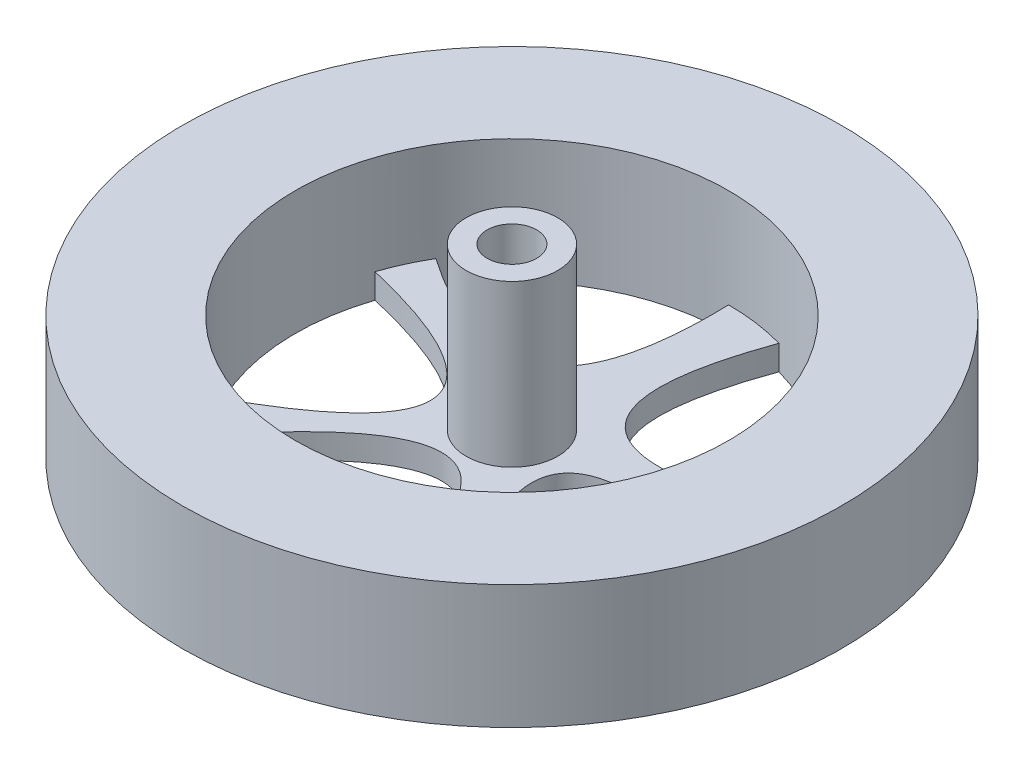
from build123d import *

# Parameters (mm, degrees)
SKETCH3_R           = 31.75
BOSS_EXTRUDE1_DEPTH = 12.7
SKETCH4_R           = 22.225
CUT_EXTRUDE1_DEPTH  = 10.16
CUT_EXTRUDE2_DEPTH  = 10.16
SKETCH8_R           = 4.694761347
BOSS_EXTRUDE2_DEPTH = 16.51
SKETCH9_R           = 2.54
CUT_EXTRUDE3_DEPTH  = 10.16
SKETCH10_W          = 2.065443221
SKETCH10_H          = 12.7


with BuildPart() as part:
    # Sketch3 → Boss-Extrude1 (new body)
    with BuildSketch(Plane(origin=(0, 0, 0), x_dir=(1, 0, 0), z_dir=(0, 1, 0))):
        with Locations(Location((0, 0, 0), (0, 0, 270))):
            Circle(SKETCH3_R)
    extrude(amount=BOSS_EXTRUDE1_DEPTH)

    # Sketch4 → Cut-Extrude1 (cut)
    with BuildSketch(Plane(origin=(0, 12.7, 0), x_dir=(1, 0, 0), z_dir=(0, 1, 0))):
        with Locations(Location((0, 0, 0), (0, 0, 270))):
            Circle(SKETCH4_R)
    extrude(amount=-CUT_EXTRUDE1_DEPTH, mode=Mode.SUBTRACT)

    # Sketch7 → Cut-Extrude2 (cut)
    with BuildSketch(Plane(origin=(0, 2.54, 0), x_dir=(1, 0, 0), z_dir=(0, 1, 0))):
        with BuildLine():
            ThreePointArc((-15.229385619, -16.18692184), (-5.02164827, -21.65025805), (6.548839828, -21.238251385))
            add(Edge.make_bspline(
                [(-15.229385619, -16.18692184), (3.307519141, 7.259643736), (6.548839828, -21.238251385)],
                knots=[0, 0, 0, 1, 1, 1], degree=2))
        make_face()
        with BuildLine():
            ThreePointArc((13.050551616, -17.989822887), (19.536316665, -10.596365234), (22.196363392, -1.127863993))
            add(Edge.make_bspline(
                [(13.050551616, -17.989822887), (-5.30189954, 6.172036524), (22.196363392, -1.127863993)],
                knots=[0, 0, 0, 1, 1, 1], degree=2))
        make_face()
        with BuildLine():
            ThreePointArc((21.254913667, 6.494556954), (15.531294033, 15.897469316), (5.997580887, 21.400459072))
            add(Edge.make_bspline(
                [(5.997580887, 21.400459072), (-2.424740226, -1.907285391), (21.254913667, 6.494556954)],
                knots=[0, 0, 0, 1, 1, 1], degree=2))
        make_face()
        with BuildLine():
            ThreePointArc((0, 22.225), (-11.007401994, 19.307711577), (-19.125106224, 11.321702033))
            add(Edge.make_bspline(
                [(0, 22.225), (0.733559441, -2.419288654), (-19.125106224, 11.321702033)],
                knots=[0, 0, 0, 1, 1, 1], degree=2))
        make_face()
        with BuildLine():
            ThreePointArc((-21.0799969, 7.041615986), (-22.014836277, -3.049198044), (-18.372518541, -12.506046036))
            add(Edge.make_bspline(
                [(-21.0799969, 7.041615986), (6.067470104, 0.607937187), (-18.372518541, -12.506046036)],
                knots=[0, 0, 0, 1, 1, 1], degree=2))
        make_face()
    extrude(amount=-CUT_EXTRUDE2_DEPTH, mode=Mode.SUBTRACT)

    # Sketch8 → Boss-Extrude2 (add)
    with BuildSketch(Plane(origin=(0, 2.54, 0), x_dir=(1, 0, 0), z_dir=(0, 1, 0))):
        with Locations(Location((0, 0, 0), (0, 0, 270))):
            Circle(SKETCH8_R)
    extrude(amount=BOSS_EXTRUDE2_DEPTH)

    # Sketch9 → Cut-Extrude3 (cut)
    with BuildSketch(Plane(origin=(0, 19.05, 0), x_dir=(1, 0, 0), z_dir=(0, 1, 0))):
        with Locations(Location((0, 0, 0), (0, 0, 270))):
            Circle(SKETCH9_R)
    extrude(amount=-CUT_EXTRUDE3_DEPTH, mode=Mode.SUBTRACT)

    # Sketch10 → Revolve1 (revolve)
    with BuildSketch(Plane.XY, mode=Mode.PRIVATE) as revolve1_sk:
        with Locations((-32.782721611, 6.35)):
            Rectangle(SKETCH10_W, SKETCH10_H)
    revolve(revolve1_sk.sketch.rotate(Axis((0, 24.137894977, 0), (0, -1, 0)), 270), axis=Axis((0, 24.137894977, 0), (0, -1, 0)))


solid = part.part
